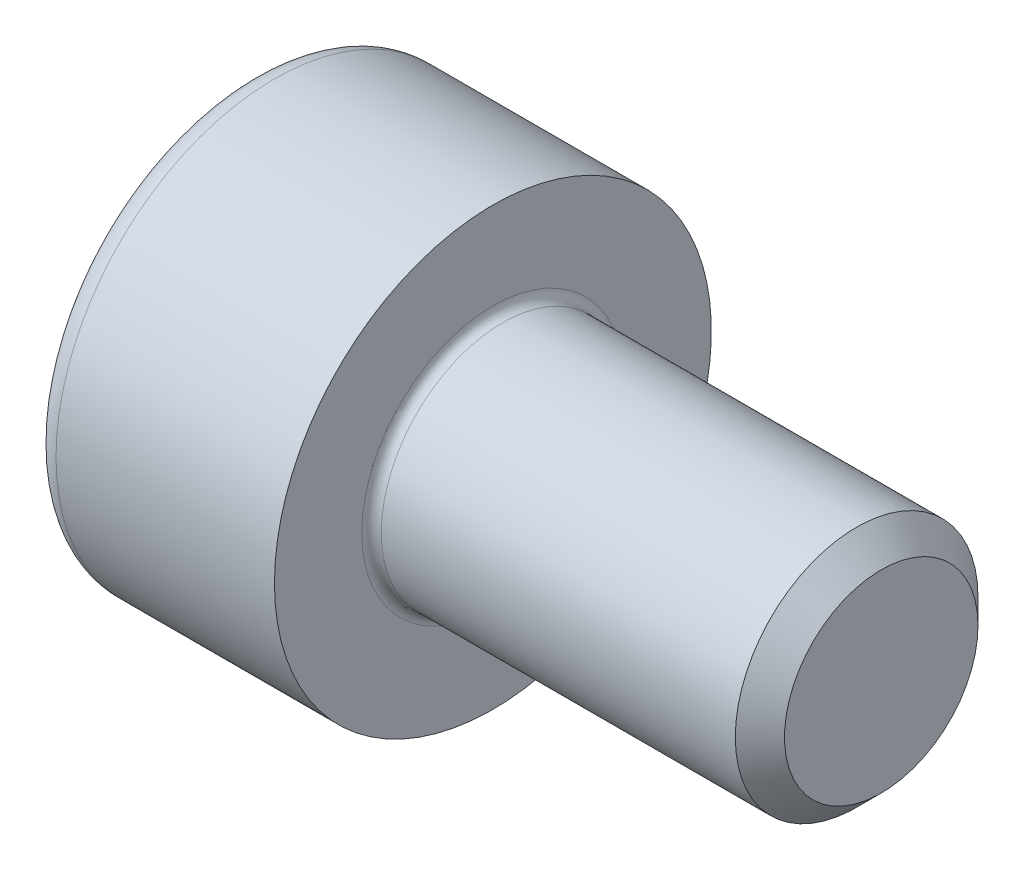
from build123d import *

# Parameters (mm, degrees)
SKETCH_1_W          = 2.5
SKETCH_1_H          = 2.25
SKETCH_2_R          = 1.25
EXTRUDE_1_DEPTH     = 4
CUT_EXTRUDE_1_DEPTH = 1.1
CHAMFER_1_SIZE      = 0.2535
FILLET_1_R          = 0.1
FILLET_2_R          = 0.25


with BuildPart() as part:
    # Эскиз1 → Повернуть1 (revolve)
    with BuildSketch(Plane(origin=(0, 0, 0), x_dir=(-1, 0, 0), z_dir=(0, 0, -1)), mode=Mode.PRIVATE) as revolve_1_sk:
        with Locations((-1.25, 1.125)):
            Rectangle(SKETCH_1_W, SKETCH_1_H)
    revolve(revolve_1_sk.sketch.rotate(Axis((2.5, 0, 0), (-1, 0, 0)), 270), axis=Axis((2.5, 0, 0), (-1, 0, 0)))

    # Эскиз2 → Бобышка-Вытянуть1 (add)
    with BuildSketch(Plane(origin=(2.5, 0, 0), x_dir=(0, 0, -1), z_dir=(1, 0, 0))):
        Circle(SKETCH_2_R)
    extrude(amount=EXTRUDE_1_DEPTH)

    # Эскиз3 → Вырез-Вытянуть1 (cut)
    with BuildSketch(Plane.ZY):
        Polygon((-1.01, -0.583123772), (0, -1.166247544), (1.01, -0.583123772), (1.01, 0.583123772), (0, 1.166247544), (-1.01, 0.583123772), align=None)
    extrude(amount=-CUT_EXTRUDE_1_DEPTH, mode=Mode.SUBTRACT)

    # Эскиз4 → Вырез-Повернуть1 (revolve, cut)
    with BuildSketch(Plane.XY, mode=Mode.PRIVATE) as cut_revolve_1_sk:
        Polygon((1.1, 1.01), (1.1, 0), (1.683123772, 0), align=None)
    revolve(cut_revolve_1_sk.sketch.rotate(Axis((1.099975, 0, 0), (1, 0, 0)), 90), axis=Axis((1.099975, 0, 0), (1, 0, 0)), mode=Mode.SUBTRACT)

    # Фаска1
    chamfer_1_edges = [part.edges().sort_by_distance(p)[0] for p in [
        (6.5, 0, 1.25),
    ]]
    chamfer(chamfer_1_edges, length=CHAMFER_1_SIZE)

    # Скругление1
    fillet_1_edges = [part.edges().sort_by_distance(p)[0] for p in [
        (2.5, 0, 1.25),
    ]]
    fillet(fillet_1_edges, radius=FILLET_1_R)

    # Скругление2
    fillet_2_edges = [part.edges().sort_by_distance(p)[0] for p in [
        (0, 0, -2.25),
    ]]
    fillet(fillet_2_edges, radius=FILLET_2_R)


solid = part.part
